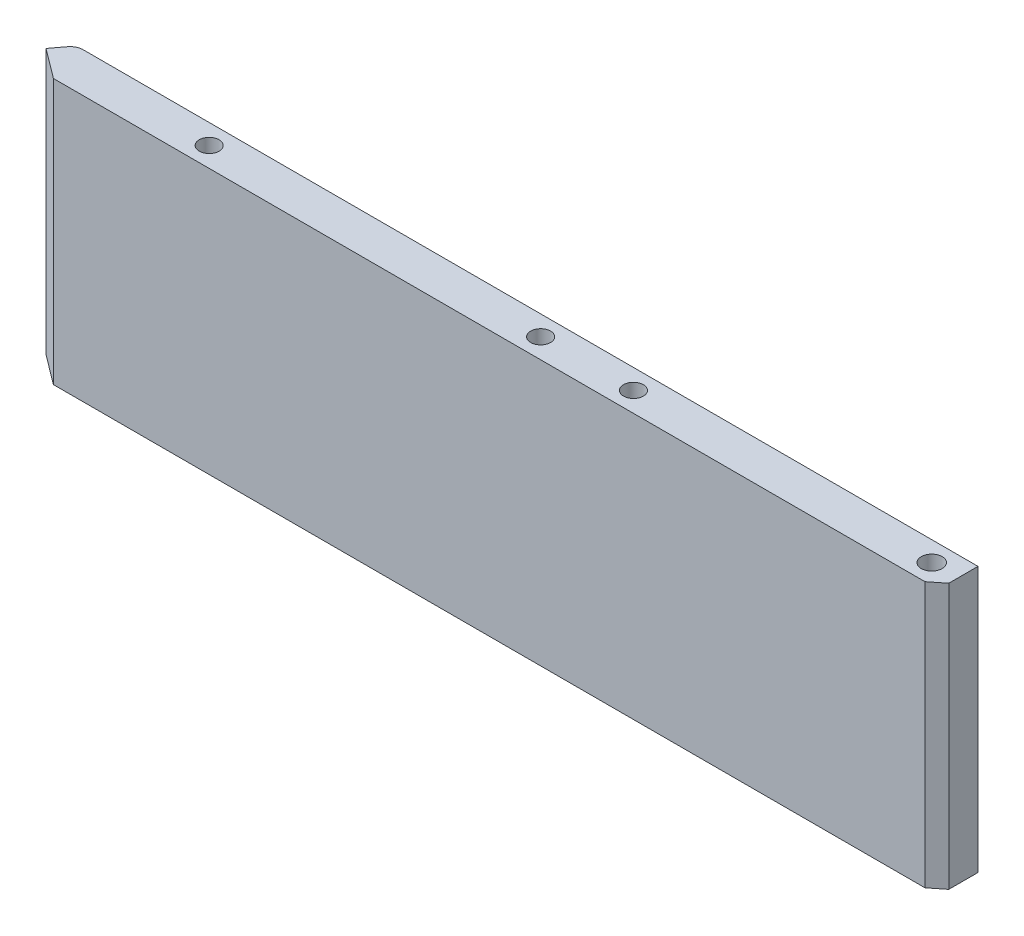
from build123d import *

# Parameters (mm, degrees)
BOSS_EXTRUDE1_DEPTH     = 20
SKETCH2_R               = 1.5
SKETCH2_R_2             = 1.572515875
CUT_EXTRUDE1_DEPTH      = 5
FILLET1_R               = 2
SKETCH3_W               = 103.784472799
SKETCH3_H               = 73.748761466
CUT_EXTRUDE2_DEPTH      = 184.826439883
CUT_EXTRUDE3_DEPTH      = 85.597401851
CUT_EXTRUDE3_DEPTH_BACK = 85.597401851
SKETCH4_W               = 26
SKETCH4_H               = 40
CUT_EXTRUDE4_DEPTH      = 100.602813213
CUT_EXTRUDE4_DEPTH_BACK = 100.602813213


with BuildPart() as part:
    # Sketch1 → Boss-Extrude1 (new, symmetric)
    with BuildSketch(Plane(origin=(0, 0, 0), x_dir=(1, 0, 0), z_dir=(0, 1, 0))):
        Polygon((-110, 0), (-80, 40), (80, 40), (110, 0), (103, 0), (77.5, 34), (-77.5, 34), (-103, 0), align=None)
    extrude(amount=BOSS_EXTRUDE1_DEPTH, both=True)

    # Sketch2 → Cut-Extrude1 (cut)
    with BuildSketch(Plane(origin=(0, 20, 0), x_dir=(1, 0, 0), z_dir=(0, 1, 0))):
        with Locations(Location((-104, 3, 0), (0, 0, 270))):
            Circle(SKETCH2_R)
        with Locations(Location((-57, 37, 0), (0, 0, 270))):
            Circle(SKETCH2_R)
        with Locations(Location((-7, 37, 0), (0, 0, 270))):
            Circle(SKETCH2_R)
        with Locations(Location((7, 37, 0), (0, 0, 90))):
            Circle(SKETCH2_R)
        with Locations(Location((104, 3, 0), (0, 0, 90))):
            Circle(SKETCH2_R)
        with Locations(Location((52, 37, 0), (0, 0, 270))):
            Circle(SKETCH2_R_2)
    extrude(amount=-CUT_EXTRUDE1_DEPTH, mode=Mode.SUBTRACT)

    # Fillet1
    fillet1_edges = [part.edges().sort_by_distance(p)[0] for p in [
        (-80, 0, -40),
        (80, 0, -40),
    ]]
    fillet(fillet1_edges, radius=FILLET1_R)

    # Sketch3 → Cut-Extrude2 (cut, symmetric)
    with BuildSketch(Plane(origin=(-65.92, 0, -49.44), x_dir=(0.5999999999999999, 0, -0.8000000000000002), z_dir=(0.8000000000000003, 0, 0.5999999999999999))):
        with Locations((-71.1922364, 16.874380733)):
            Rectangle(SKETCH3_W, SKETCH3_H)
    cut_extrude2 = extrude(amount=CUT_EXTRUDE2_DEPTH, both=True, mode=Mode.SUBTRACT)

    # Mirror1: Cut-Extrude2 across plane
    add(cut_extrude2.mirror(Plane(origin=(0, 0, 0), x_dir=(0, 0, 1), z_dir=(1, 0, 0))), mode=Mode.SUBTRACT)

    # Sketch4 → Cut-Extrude3 (cut, two sides: drawn at the far end of the back side and taken through both)
    with BuildSketch(Plane.XY.offset(-34).offset(-CUT_EXTRUDE3_DEPTH_BACK)):
        with Locations((68.98, 0)):
            Rectangle(SKETCH4_W, SKETCH4_H)
    extrude(amount=CUT_EXTRUDE3_DEPTH + CUT_EXTRUDE3_DEPTH_BACK, mode=Mode.SUBTRACT)

    # Sketch5 → Cut-Extrude4 (cut, two sides: drawn at the far end of the back side and taken through both)
    with BuildSketch(Plane.XZ.offset(20).offset(-CUT_EXTRUDE4_DEPTH_BACK)):
        Polygon((55.98, -35.588024178), (53.98, -34), (55.98, -34), align=None)
    extrude(amount=CUT_EXTRUDE4_DEPTH + CUT_EXTRUDE4_DEPTH_BACK, mode=Mode.SUBTRACT)


solid = part.part
